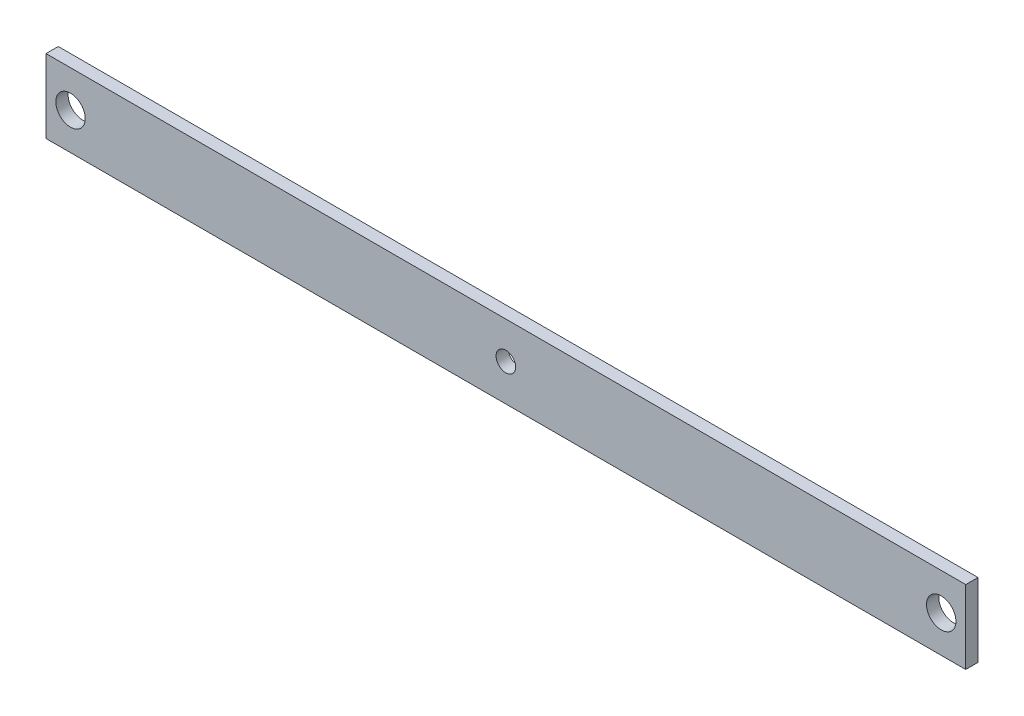
from build123d import *

# Parameters (mm, degrees)
SKETCH_1_W      = 375
SKETCH_1_H      = 30
SKETCH_1_R      = 4
SKETCH_1_R_2    = 6
EXTRUDE_1_DEPTH = 5


with BuildPart() as part:
    # 草图1 → 凸台-拉伸1 (new body)
    with BuildSketch(Plane.XY):
        Rectangle(SKETCH_1_W, SKETCH_1_H)
        Circle(SKETCH_1_R, mode=Mode.SUBTRACT)
        with Locations((-177.5, 0)):
            Circle(SKETCH_1_R_2, mode=Mode.SUBTRACT)
        with Locations((177.5, 0)):
            Circle(SKETCH_1_R_2, mode=Mode.SUBTRACT)
    extrude(amount=EXTRUDE_1_DEPTH)


solid = part.part
